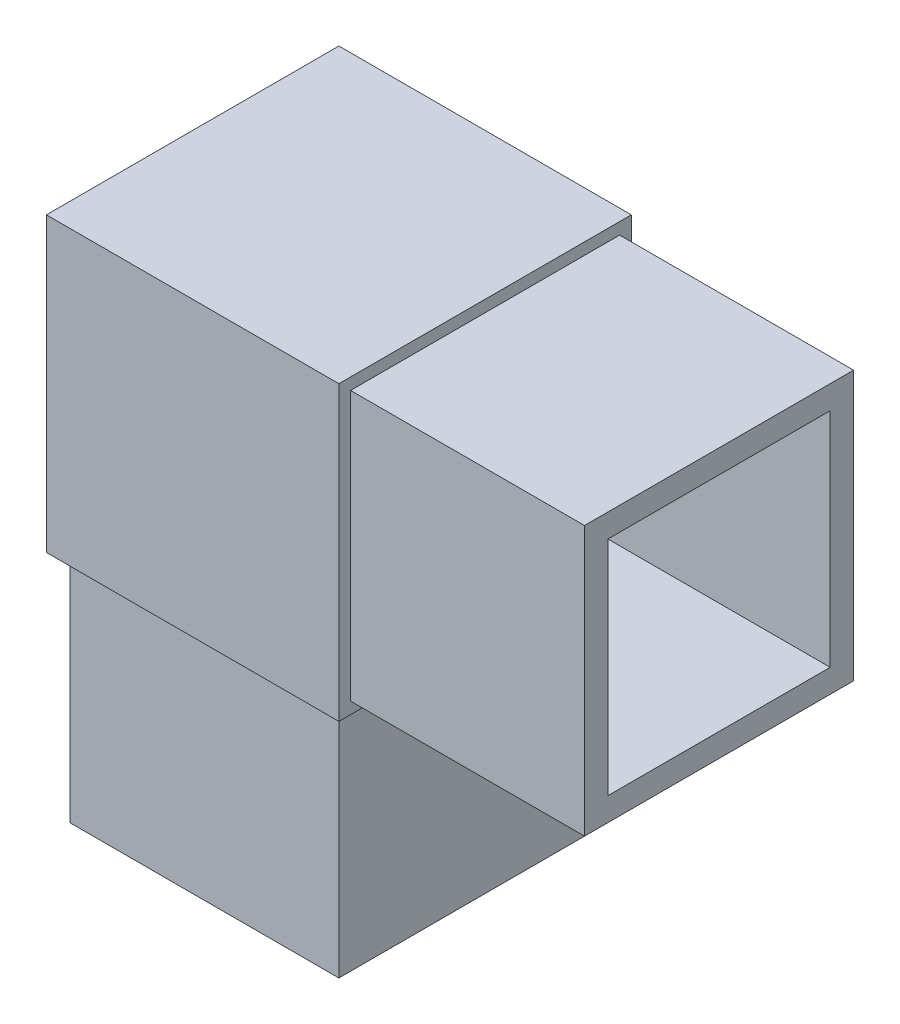
from build123d import *

# Parameters (mm, degrees)
SKETCH1_W           = 45
SKETCH1_H           = 45
BOSS_EXTRUDE1_DEPTH = 25
SKETCH2_W           = 20
SKETCH2_H           = 20
CUT_EXTRUDE1_DEPTH  = 187.975674979
SKETCH3_W           = 25
SKETCH3_H           = 25
SKETCH3_W_2         = 23
SKETCH3_H_2         = 23
CUT_EXTRUDE2_DEPTH  = 20
SKETCH4_W           = 25
SKETCH4_H           = 25
SKETCH4_W_2         = 23
SKETCH4_H_2         = 23
CUT_EXTRUDE3_DEPTH  = 20
SKETCH7_W           = 19
SKETCH7_H           = 19
CUT_EXTRUDE7_DEPTH  = 42
SKETCH8_W           = 19
SKETCH8_H           = 19
CUT_EXTRUDE8_DEPTH  = 42


with BuildPart() as part:
    # Sketch1 → Boss-Extrude1 (new body)
    with BuildSketch(Plane.XY):
        with Locations((-22.649542037, -157.212052706)):
            Rectangle(SKETCH1_W, SKETCH1_H)
    extrude(amount=BOSS_EXTRUDE1_DEPTH)

    # Sketch2 → Cut-Extrude1 (cut, through all)
    with BuildSketch(Plane.XY.offset(25)):
        with Locations((-10.149542037, -169.712052706)):
            Rectangle(SKETCH2_W, SKETCH2_H)
    extrude(amount=-CUT_EXTRUDE1_DEPTH, mode=Mode.SUBTRACT)

    # Sketch3 → Cut-Extrude2 (cut)
    with BuildSketch(Plane(origin=(-0.149542037, 0, 0), x_dir=(0, 0, -1), z_dir=(1, 0, 0))):
        with Locations((-12.5, -147.212052706)):
            Rectangle(SKETCH3_W, SKETCH3_H)
        with Locations((-12.5, -147.212052706)):
            Rectangle(SKETCH3_W_2, SKETCH3_H_2, mode=Mode.SUBTRACT)
    extrude(amount=-CUT_EXTRUDE2_DEPTH, mode=Mode.SUBTRACT)

    # Sketch4 → Cut-Extrude3 (cut)
    with BuildSketch(Plane.XZ.offset(179.712052706)):
        with Locations((-32.649542037, 12.5)):
            Rectangle(SKETCH4_W, SKETCH4_H)
        with Locations((-32.649542037, 12.5)):
            Rectangle(SKETCH4_W_2, SKETCH4_H_2, mode=Mode.SUBTRACT)
    extrude(amount=-CUT_EXTRUDE3_DEPTH, mode=Mode.SUBTRACT)

    # Sketch7 → Cut-Extrude7 (cut)
    with BuildSketch(Plane(origin=(-0.149542037, 0, 0), x_dir=(0, 0, -1), z_dir=(1, 0, 0))):
        with Locations((-12.5, -147.212052706)):
            Rectangle(SKETCH7_W, SKETCH7_H)
    extrude(amount=-CUT_EXTRUDE7_DEPTH, mode=Mode.SUBTRACT)

    # Sketch8 → Cut-Extrude8 (cut)
    with BuildSketch(Plane.XZ.offset(179.712052706)):
        with Locations((-32.649542037, 12.5)):
            Rectangle(SKETCH8_W, SKETCH8_H)
    extrude(amount=-CUT_EXTRUDE8_DEPTH, mode=Mode.SUBTRACT)


solid = part.part
